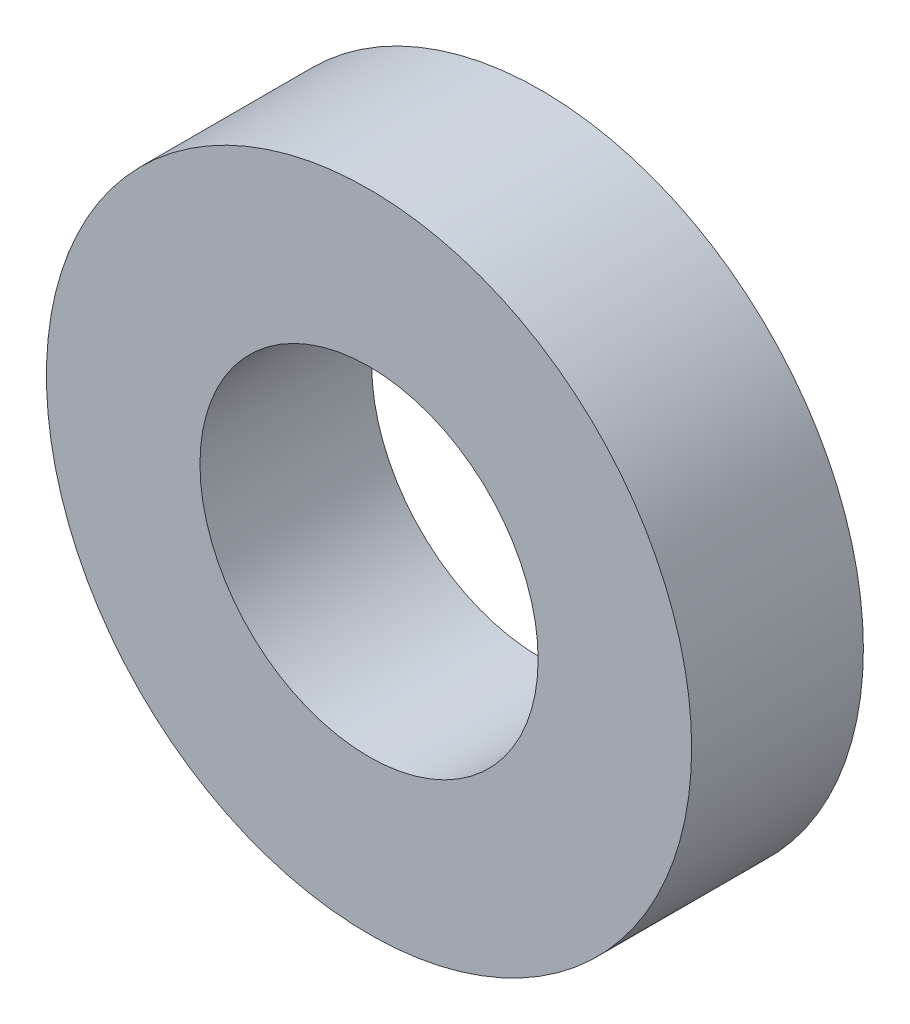
from build123d import *

# Parameters (mm, degrees)
ESQUISSE1_R        = 7.89
ESQUISSE1_R_2      = 4.135
BOSS_EXTRU_1_DEPTH = 4.2


with BuildPart() as part:
    # Esquisse1 → Boss.-Extru.1 (new body)
    with BuildSketch(Plane(origin=(0, 0, 0), x_dir=(0, 1, 0), z_dir=(0, 0, 1))):
        with Locations(Location((0, 0, 0), (0, 0, 270))):
            Circle(ESQUISSE1_R)
        with Locations(Location((0, 0, 0), (0, 0, 270))):
            Circle(ESQUISSE1_R_2, mode=Mode.SUBTRACT)
    extrude(amount=BOSS_EXTRU_1_DEPTH)


solid = part.part
